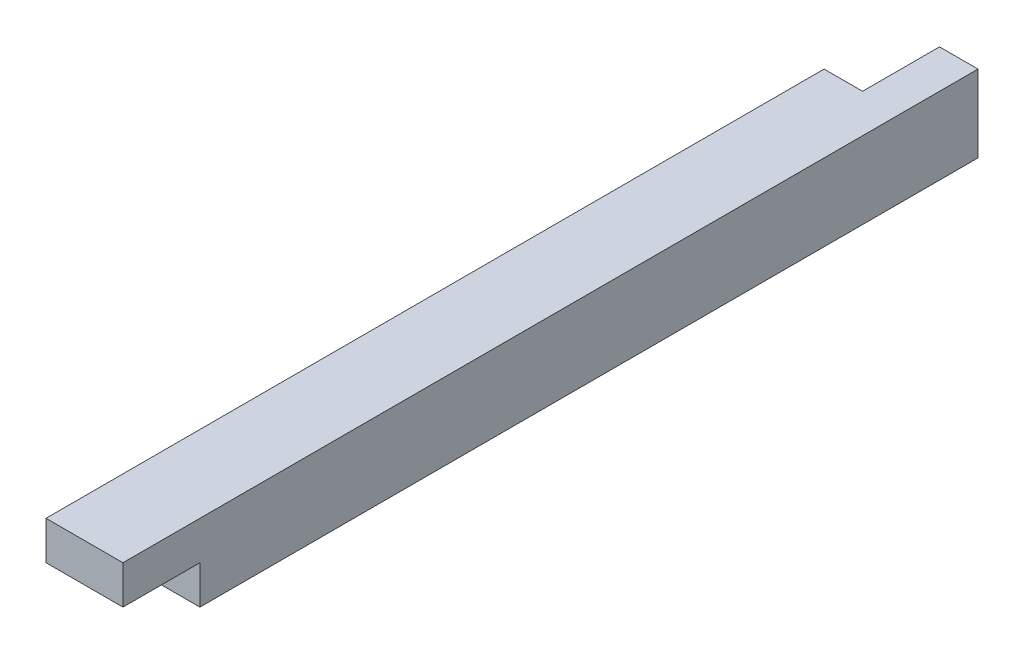
from build123d import *

# Parameters (mm, degrees)
SKETCH1_W           = 90
SKETCH1_H           = 90
BOSS_EXTRUDE1_DEPTH = 1000
SKETCH3_W           = 90
SKETCH3_H           = 90
CUT_EXTRUDE1_DEPTH  = 45
SKETCH4_W           = 90
SKETCH4_H           = 90
CUT_EXTRUDE2_DEPTH  = 45


with BuildPart() as part:
    # Sketch1 → Boss-Extrude1 (new body)
    with BuildSketch(Plane.XY):
        with Locations((45, 45)):
            Rectangle(SKETCH1_W, SKETCH1_H)
    extrude(amount=BOSS_EXTRUDE1_DEPTH)

    # Sketch3 → Cut-Extrude1 (cut)
    with BuildSketch(Plane.XZ):
        with Locations((45, 955)):
            Rectangle(SKETCH3_W, SKETCH3_H)
    extrude(amount=-CUT_EXTRUDE1_DEPTH, mode=Mode.SUBTRACT)

    # Sketch4 → Cut-Extrude2 (cut)
    with BuildSketch(Plane.ZY):
        with Locations((45, 45)):
            Rectangle(SKETCH4_W, SKETCH4_H)
    extrude(amount=-CUT_EXTRUDE2_DEPTH, mode=Mode.SUBTRACT)


solid = part.part
